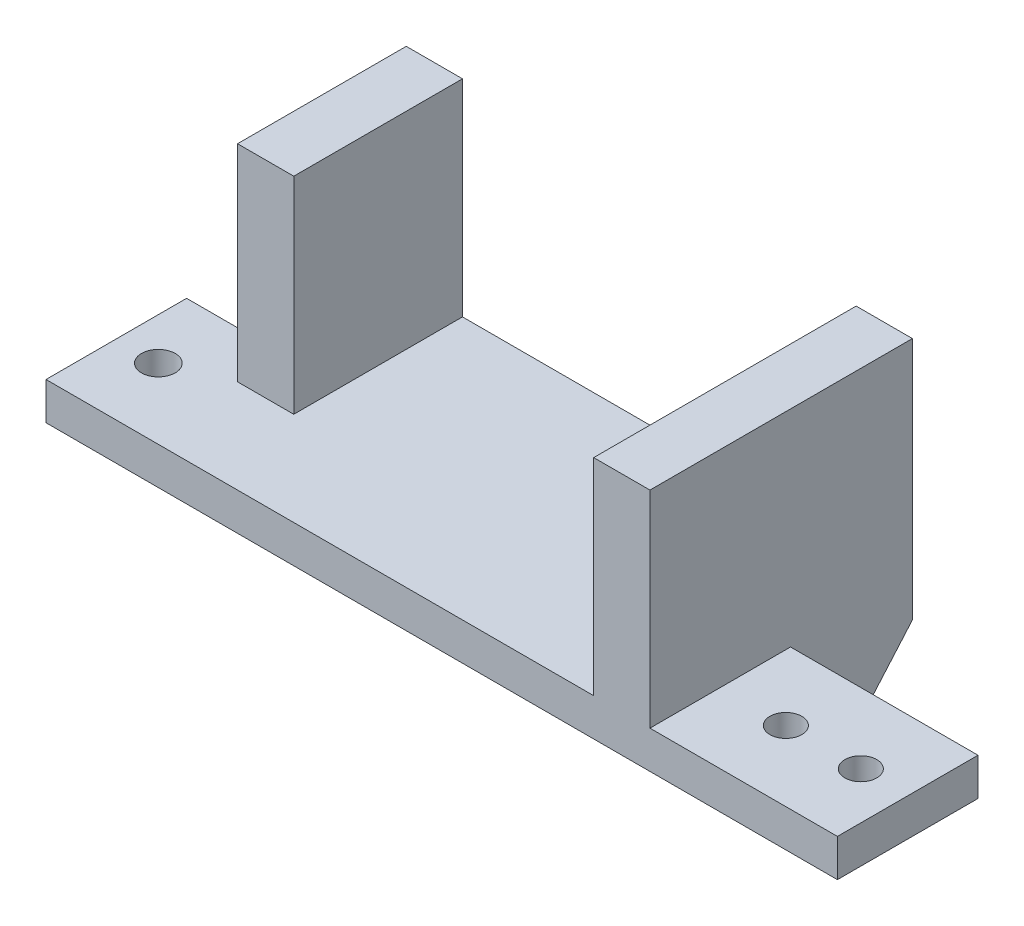
from build123d import *

# Parameters (mm, degrees)
SKETCH1_W           = 21
SKETCH1_H           = 4
BOSS_EXTRUDE1_DEPTH = 15
BOSS_EXTRUDE2_DEPTH = 13
SKETCH3_R           = 1.8
CUT_EXTRUDE1_DEPTH  = 10
SKETCH4_W           = 9.565194399
SKETCH4_H           = 15
SKETCH4_R           = 1.8
SKETCH4_R_2         = 1.7
CUT_EXTRUDE2_DEPTH  = 15
SKETCH5_W           = 6
SKETCH5_H           = 10
CUT_EXTRUDE3_DEPTH  = 22
BOSS_EXTRUDE3_DEPTH = 54
SKETCH7_W           = 18
SKETCH7_H           = 15
CUT_EXTRUDE4_DEPTH  = 11


with BuildPart() as part:
    # Sketch1 → Boss-Extrude1 (new body)
    with BuildSketch(Plane.XY):
        Polygon((47, 0), (21, 0), (21, 26), (27, 26), (27, 4), (47, 4), align=None)
        with Locations((-10.5, 2)):
            Rectangle(SKETCH1_W, SKETCH1_H)
        with Locations((10.5, 2)):
            Rectangle(SKETCH1_W, SKETCH1_H)
        Polygon((-47, 0), (-21, 0), (-21, 26), (-27, 26), (-27, 4), (-47, 4), align=None)
    extrude(amount=BOSS_EXTRUDE1_DEPTH)

    # Sketch2 → Boss-Extrude2 (add)
    with BuildSketch(Plane(origin=(0, 0, 0), x_dir=(-1, 0, 0), z_dir=(0, 0, -1))):
        Polygon((-27, 26), (-27, 0), (27, 0), (27, 4), (27, 26), (21, 26), (21, 4), (-21, 4), (-21, 26), align=None)
    extrude(amount=BOSS_EXTRUDE2_DEPTH)

    # Sketch3 → Cut-Extrude1 (cut)
    with BuildSketch(Plane(origin=(0, 0, -13), x_dir=(-1, 0, 0), z_dir=(0, 0, -1))):
        with BuildLine():
            ThreePointArc((-22.2, 20.95), (-22.727207794, 22.222792206), (-24, 22.75))
            Line((-24, 22.75), (-24, 20.95))
            Line((-24, 20.95), (-24, 19.15))
            ThreePointArc((-24, 19.15), (-22.727207794, 19.677207794), (-22.2, 20.95))
        make_face()
        with BuildLine():
            Line((-24, 20.95), (-24, 22.75))
            ThreePointArc((-24, 22.75), (-25.8, 20.95), (-24, 19.15))
            Line((-24, 19.15), (-24, 20.95))
        make_face()
        with Locations((-24, 11.05)):
            Circle(SKETCH3_R)
        with Locations((24, 20.95)):
            Circle(SKETCH3_R)
        with Locations((24, 11.05)):
            Circle(SKETCH3_R)
    extrude(amount=-CUT_EXTRUDE1_DEPTH, mode=Mode.SUBTRACT)

    # Sketch4 → Cut-Extrude2 (cut)
    with BuildSketch(Plane(origin=(0, 4, 0), x_dir=(1, 0, 0), z_dir=(0, 1, 0))):
        with Locations((-42.2174028, -7.5)):
            Rectangle(SKETCH4_W, SKETCH4_H)
        with Locations(Location((-32.949794347, -7.5, 0), (0, 0, 180))):
            Circle(SKETCH4_R)
        with Locations(Location((42, -7.5, 0), (0, 0, 180))):
            Circle(SKETCH4_R_2)
        with Locations(Location((34, -7.5, 0), (0, 0, 180))):
            Circle(SKETCH4_R_2)
    extrude(amount=-CUT_EXTRUDE2_DEPTH, mode=Mode.SUBTRACT)

    # Sketch5 → Cut-Extrude3 (cut)
    with BuildSketch(Plane(origin=(0, 26, 0), x_dir=(1, 0, 0), z_dir=(0, 1, 0))):
        with Locations((-24, -10)):
            Rectangle(SKETCH5_W, SKETCH5_H)
    extrude(amount=-CUT_EXTRUDE3_DEPTH, mode=Mode.SUBTRACT)

    # Sketch6 → Boss-Extrude3 (add)
    with BuildSketch(Plane.ZY.offset(27)):
        Polygon((-13, 0), (0, 0), (0, -15), align=None)
    extrude(amount=-BOSS_EXTRUDE3_DEPTH)

    # Sketch7 → Cut-Extrude4 (cut)
    with BuildSketch(Plane(origin=(0, 0, -13), x_dir=(-1, 0, 0), z_dir=(0, 0, -1))):
        with Locations((-12, -7.5)):
            Rectangle(SKETCH7_W, SKETCH7_H)
        with Locations((12, -7.5)):
            Rectangle(SKETCH7_W, SKETCH7_H)
    extrude(amount=-CUT_EXTRUDE4_DEPTH, mode=Mode.SUBTRACT)


solid = part.part
